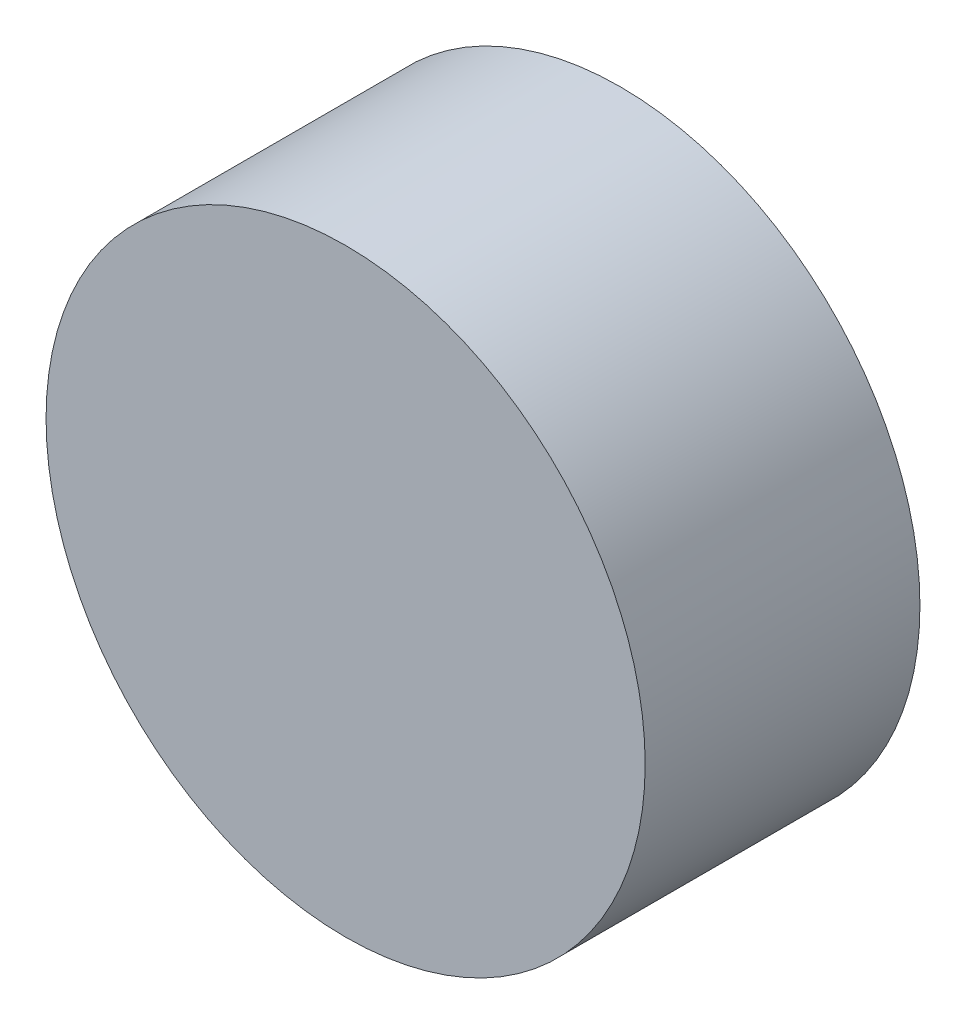
from build123d import *

# Parameters (mm, degrees)
SKETCH1_R           = 7.366
BOSS_EXTRUDE1_DEPTH = 6.7564


with BuildPart() as part:
    # Sketch1 → Boss-Extrude1 (new body)
    with BuildSketch(Plane.XY):
        Circle(SKETCH1_R)
    extrude(amount=BOSS_EXTRUDE1_DEPTH)


solid = part.part
